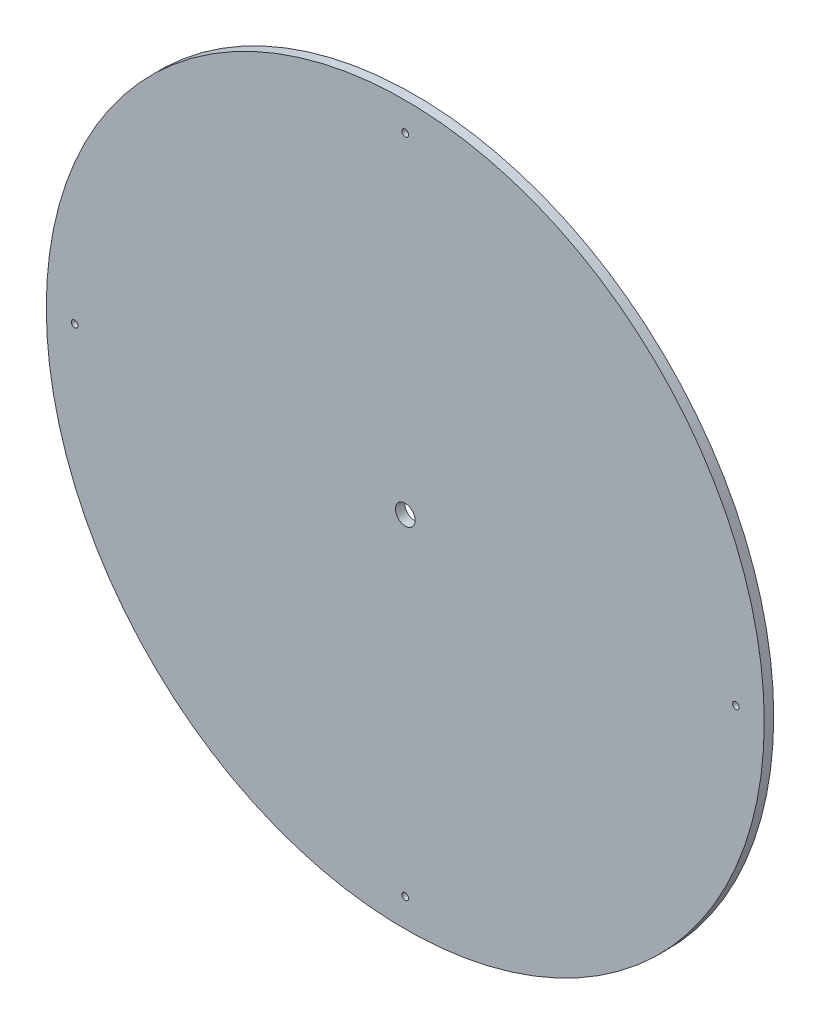
from build123d import *

# Parameters (mm, degrees)
IZIM1_R                     = 455
Y_KSEKLIK_EKSTR_ZYON1_DEPTH = 12
IZIM2_R                     = 12.5
KES_EKSTR_ZYON1_DEPTH       = 644.579054973
F_8_5_8_5_AP_DELIK1_D       = 8.5


with BuildPart() as part:
    # Çizim1 → Yükseklik-Ekstrüzyon1 (new body)
    with BuildSketch(Plane.XY):
        Circle(IZIM1_R)
    extrude(amount=Y_KSEKLIK_EKSTR_ZYON1_DEPTH)

    # Çizim2 → Kes-Ekstrüzyon1 (cut, through all)
    with BuildSketch(Plane.XY.offset(12)):
        Circle(IZIM2_R)
    extrude(amount=-KES_EKSTR_ZYON1_DEPTH, mode=Mode.SUBTRACT)

    # Ø8.5 (8.5) Çap Delik1 (through all)
    with Locations(Plane.XY.offset(12)):
        with Locations((0, 419), (419, 0), (0, -419), (-419, 0)):
            Hole(F_8_5_8_5_AP_DELIK1_D / 2)


solid = part.part
